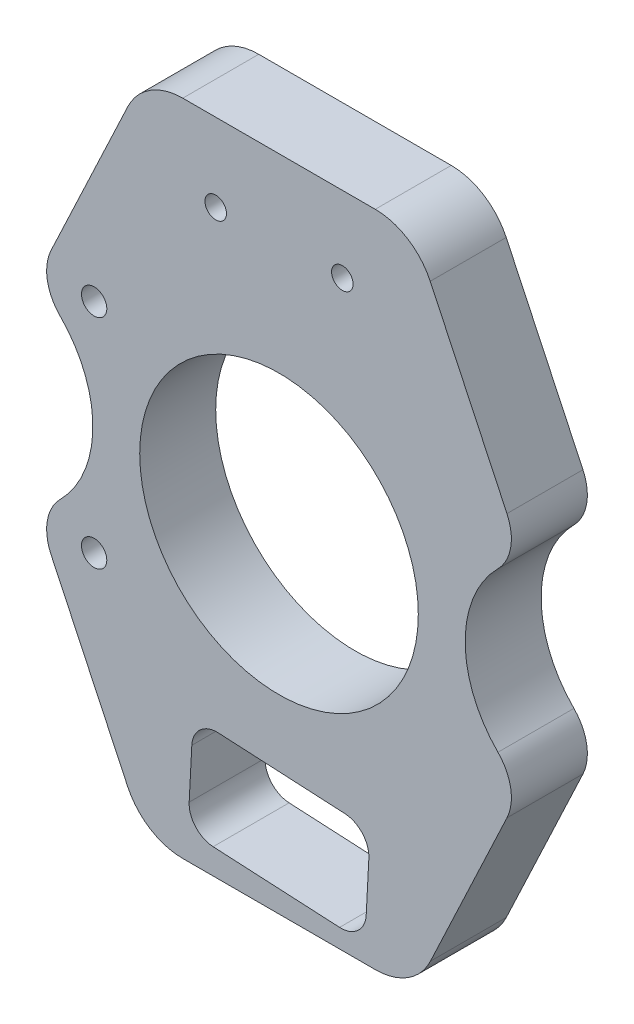
from build123d import *

# Parameters (mm, degrees)
SZKIC1_R                    = 55
SZKIC1_R_2                  = 5
SZKIC1_R_3                  = 4.25
DODANIE_WYCI_GNI_CIE1_DEPTH = 30
WYTNIJ_WYCI_GNI_CIE1_DEPTH  = 30
ZAOKR_GLENIE1_R             = 10


with BuildPart() as part:
    # Szkic1 → Dodanie-wyciągnięcie1 (new body)
    with BuildSketch(Plane.XY):
        with BuildLine():
            Line((-38, 260), (38, 260))
            ThreePointArc((38, 260), (50.853486978, 256.267902519), (59.709435091, 246.232322709))
            Line((59.709435091, 246.232322709), (90.008216267, 181.948831851))
            ThreePointArc((90.008216267, 181.948831851), (91.483769879, 171.062118236), (86.44222441, 161.300939461))
            ThreePointArc((86.44222441, 161.300939461), (73.499977081, 129.92645546), (86.44222441, 98.551971459))
            ThreePointArc((86.44222441, 98.551971459), (91.483769879, 88.790792684), (90.008216267, 77.904079069))
            Line((90.008216267, 77.904079069), (59.766160901, 13.740940677))
            ThreePointArc((59.766160901, 13.740940677), (50.88106069, 3.705595357), (38, 0))
            Line((38, 0), (0, 0))
            Line((0, 0), (-38, 0))
            ThreePointArc((-38, 0), (-50.88106069, 3.705595357), (-59.766160901, 13.740940677))
            Line((-59.766160901, 13.740940677), (-90.008216267, 77.904079069))
            ThreePointArc((-90.008216267, 77.904079069), (-91.483769879, 88.790792684), (-86.44222441, 98.551971459))
            ThreePointArc((-86.44222441, 98.551971459), (-73.499977081, 129.92645546), (-86.44222441, 161.300939461))
            ThreePointArc((-86.44222441, 161.300939461), (-91.483769879, 171.062118236), (-90.008216267, 181.948831851))
            Line((-90.008216267, 181.948831851), (-59.709435091, 246.232322709))
            ThreePointArc((-59.709435091, 246.232322709), (-50.853486978, 256.267902519), (-38, 260))
        make_face()
        with Locations((0, 130)):
            Circle(SZKIC1_R, mode=Mode.SUBTRACT)
        with Locations((-73, 87)):
            Circle(SZKIC1_R_2, mode=Mode.SUBTRACT)
        with Locations(Location((-73, 173, 0), (0, 0, 180))):
            Circle(SZKIC1_R_2, mode=Mode.SUBTRACT)
        with Locations((25, 230)):
            Circle(SZKIC1_R_3, mode=Mode.SUBTRACT)
        with Locations((-24.992384758, 229.127379678)):
            Circle(SZKIC1_R_3, mode=Mode.SUBTRACT)
        with Locations((-25, 30)):
            Circle(SZKIC1_R_3, mode=Mode.SUBTRACT)
        with Locations((24.931476738, 27.383202188)):
            Circle(SZKIC1_R_3, mode=Mode.SUBTRACT)
    extrude(amount=DODANIE_WYCI_GNI_CIE1_DEPTH)

    # Szkic4 → Wytnij-wyciągnięcie1 (cut)
    with BuildSketch(Plane(origin=(-86.44222441, 98.551971459, 0), x_dir=(-1, 0, 0), z_dir=(0, 0, -1))):
        Polygon((-52.536909819, -48.057816777), (-50.443471569, -88.002998167), (-120.347539002, -91.666515104), (-122.440977251, -51.721333714), align=None)
    extrude(amount=-WYTNIJ_WYCI_GNI_CIE1_DEPTH, mode=Mode.SUBTRACT)

    # Zaokrąglenie1
    zaokr_glenie1_edges = [part.edges().sort_by_distance(p)[0] for p in [
        (35.998752841, 46.830637745, 15),
        (-33.905314592, 50.494154682, 15),
        (-35.998752841, 10.548973291, 15),
        (33.905314592, 6.885456354, 15),
    ]]
    fillet(zaokr_glenie1_edges, radius=ZAOKR_GLENIE1_R)


solid = part.part
